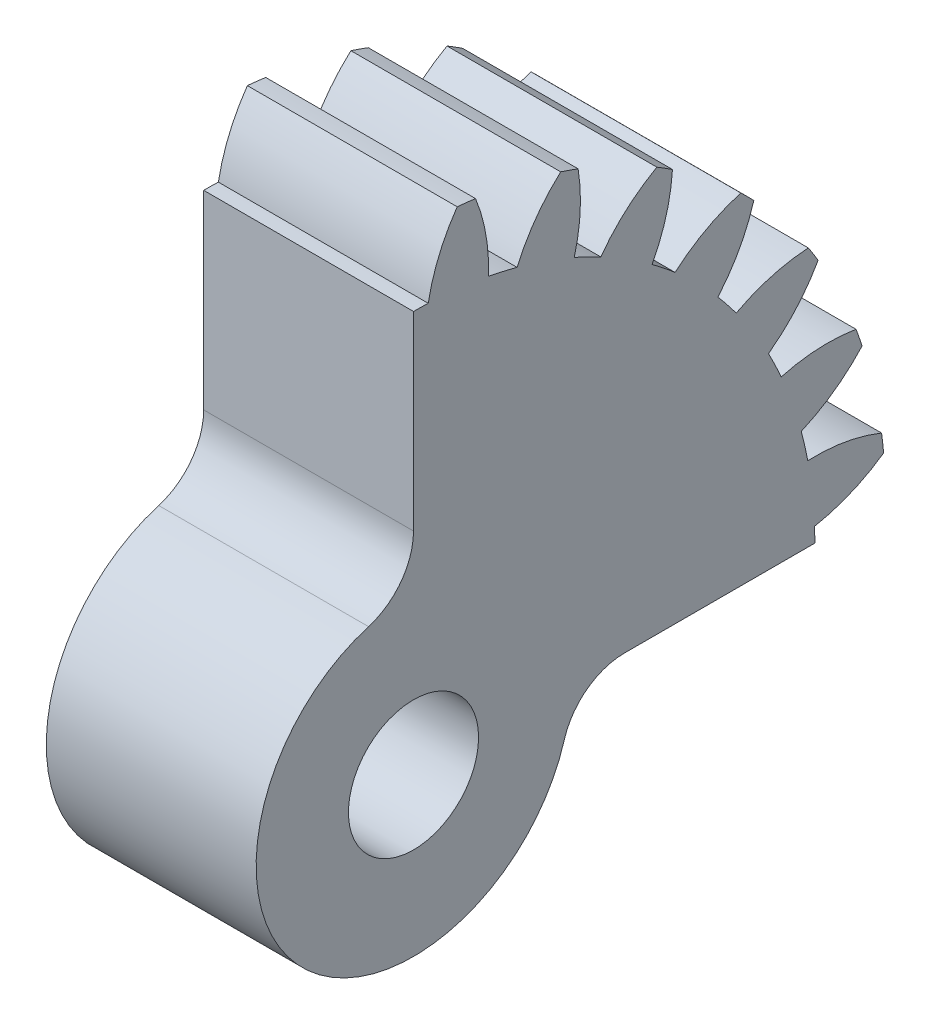
from build123d import *

# Parameters (mm, degrees)
BASPROSKE_W        = 10
BASPROSKE_H        = 22.5
TOOTHCUT_DEPTH     = 34.35416016
TEETHCUTS_COUNT    = 28
TEETHCUTS_ANGLE    = 347.142857143
BORSKE_R           = 7.5
BORE_DEPTH         = 50.0000508
CROQUIS1_OUTSIDE_W = 59.636
CROQUIS1_OUTSIDE_H = 59.636
EXTRUIR1_DEPTH     = 10
CROQUIS2_R         = 7.5
CROQUIS2_R_2       = 3.1
EXTRUIR2_DEPTH     = 10
REDONDEO1_R        = 3


with BuildPart() as part:
    # BasProSke → Base-Revolve (revolve)
    with BuildSketch(Plane(origin=(0, 0, 0), x_dir=(1, 0, 0), z_dir=(0, 1, 0)), mode=Mode.PRIVATE) as base_revolve_sk:
        with Locations((5, 11.25)):
            Rectangle(BASPROSKE_W, BASPROSKE_H)
    revolve(base_revolve_sk.sketch.rotate(Axis((-10, 0, 0), (1, 0, 0)), 180), axis=Axis((-10, 0, 0), (1, 0, 0)))

    # TooCutSke → ToothCut (cut, through all)
    with BuildSketch(Plane(origin=(0, 0, 0), x_dir=(0, 0, -1), z_dir=(1, 0, 0))):
        with BuildLine():
            ThreePointArc((0.70071741, 19.111158288), (0, 19.124), (-0.70071741, 19.111158288))
            ThreePointArc((-0.70071741, 19.111158288), (-1.220048441, 20.845037035), (-2.098754998, 22.427413418))
            ThreePointArc((-2.098754998, 22.427413418), (0, 22.5254), (2.098754998, 22.427413418))
            ThreePointArc((2.098754998, 22.427413418), (1.220048441, 20.845037035), (0.70071741, 19.111158288))
        make_face()
    toothcut = extrude(amount=TOOTHCUT_DEPTH, mode=Mode.SUBTRACT)

    # TeethCuts: ToothCut ×28 about axis
    teethcuts_axis = Axis((-10, 0, 0), (1, 0, 0))
    for i in range(1, TEETHCUTS_COUNT):
        add(toothcut.rotate(teethcuts_axis, i * TEETHCUTS_ANGLE / (TEETHCUTS_COUNT - 1)), mode=Mode.SUBTRACT)

    # BorSke → Bore (cut, symmetric)
    with BuildSketch(Plane(origin=(0, 0, 0), x_dir=(0, 0, -1), z_dir=(1, 0, 0))):
        with Locations(Location((0, 0, 0), (0, 0, 180))):
            Circle(BORSKE_R)
    extrude(amount=BORE_DEPTH, both=True, mode=Mode.SUBTRACT)

    # Croquis1 outside → Extruir1 (cut)
    with BuildSketch(Plane(origin=(10, 0, 0), x_dir=(0, 0, -1), z_dir=(1, 0, 0))):
        Rectangle(CROQUIS1_OUTSIDE_W, CROQUIS1_OUTSIDE_H)
        with BuildLine():
            Line((0, 19.124), (0, 0))
            Line((0, 0), (19.124, 0))
            ThreePointArc((19.124, 0), (29.041866068, 29.041866068), (0, 19.124))
        make_face(mode=Mode.SUBTRACT)
    extrude(amount=-EXTRUIR1_DEPTH, mode=Mode.SUBTRACT)

    # Croquis2 → Extruir2 (add, through all)
    with BuildSketch(Plane(origin=(10, 0, 0), x_dir=(0, 0, -1), z_dir=(1, 0, 0))):
        Circle(CROQUIS2_R)
        Circle(CROQUIS2_R_2, mode=Mode.SUBTRACT)
    extrude(amount=-EXTRUIR2_DEPTH)

    # Redondeo1
    redondeo1_edges = [part.edges().sort_by_distance(p)[0] for p in [
        (5, 7.5, 0),
        (5, 0, -7.5),
    ]]
    fillet(redondeo1_edges, radius=REDONDEO1_R)


solid = part.part
